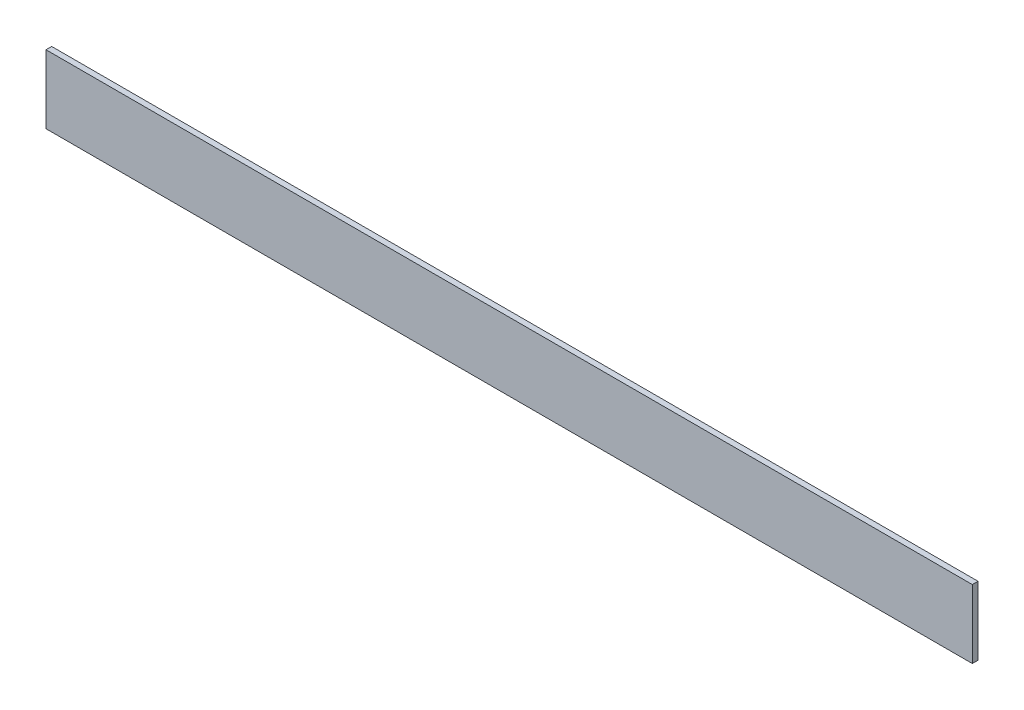
from build123d import *

# Parameters (mm, degrees)
SKETCH1_W           = 1031.748
SKETCH1_H           = 76.2
BOSS_EXTRUDE1_DEPTH = 6.35


with BuildPart() as part:
    # Sketch1 → Boss-Extrude1 (new body)
    with BuildSketch(Plane.XY):
        Rectangle(SKETCH1_W, SKETCH1_H)
    extrude(amount=BOSS_EXTRUDE1_DEPTH)


solid = part.part
